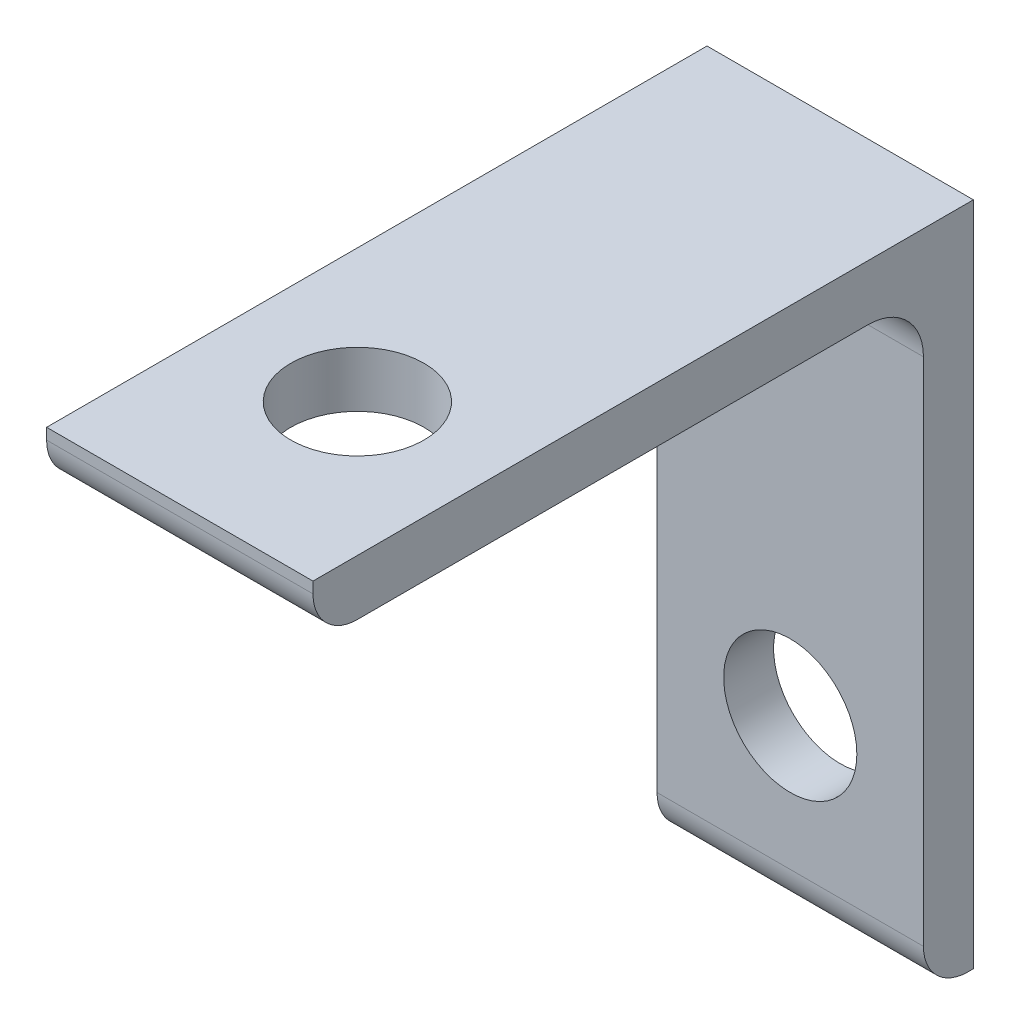
from build123d import *

# Parameters (mm, degrees)
ESBO_O1_W                = 1.2
ESBO_O1_H                = 3
RESSALTO_EXTRUS_O1_DEPTH = 0.225
ESBO_O2_W                = 2.75
ESBO_O2_H                = 0.25
RESSALTO_EXTRUS_O2_DEPTH = 1.2
RESSALTO_EXTRUS_O3_DEPTH = 1.2
CORTE_EXTRUS_O1_DEPTH    = 1.2
ESBO_O8_R                = 0.3
CORTE_EXTRUS_O2_DEPTH    = 1.2
ESBO_O9_R                = 0.3
CORTE_EXTRUS_O3_DEPTH    = 1.2


with BuildPart() as part:
    # Esboço1 → Ressalto-extrusão1 (new body)
    with BuildSketch(Plane.XY):
        with Locations((-16.903502085, -4.953296555)):
            Rectangle(ESBO_O1_W, ESBO_O1_H)
    extrude(amount=RESSALTO_EXTRUS_O1_DEPTH)

    # Esboço2 → Ressalto-extrusão2 (add)
    with BuildSketch(Plane.ZY.offset(17.503502085)):
        with Locations((1.6, -3.578296555)):
            Rectangle(ESBO_O2_W, ESBO_O2_H)
    extrude(amount=-RESSALTO_EXTRUS_O2_DEPTH)

    # Esboço6 → Ressalto-extrusão3 (add)
    with BuildSketch(Plane.ZY.offset(17.503502085)):
        with BuildLine():
            Line((0.225, -3.703296555), (0.225, -3.953296555))
            ThreePointArc((0.225, -3.953296555), (0.298223305, -3.776519859), (0.475, -3.703296555))
            Line((0.475, -3.703296555), (0.225, -3.703296555))
        make_face()
    extrude(amount=-RESSALTO_EXTRUS_O3_DEPTH)

    # Esboço7 → Corte-extrusão1 (cut)
    with BuildSketch(Plane.ZY.offset(17.503502085)):
        with BuildLine():
            Line((2.975, -3.703296555), (2.975, -3.503296555))
            ThreePointArc((2.975, -3.503296555), (2.916421356, -3.644717911), (2.775, -3.703296555))
            Line((2.775, -3.703296555), (2.975, -3.703296555))
        make_face()
        with BuildLine():
            ThreePointArc((0.225, -6.253296555), (0.166421356, -6.394717911), (0.025, -6.453296555))
            Line((0.025, -6.453296555), (0.225, -6.453296555))
            Line((0.225, -6.453296555), (0.225, -6.253296555))
        make_face()
    extrude(amount=-CORTE_EXTRUS_O1_DEPTH, mode=Mode.SUBTRACT)

    # Esboço8 → Corte-extrusão2 (cut)
    with BuildSketch(Plane.XY.offset(0.225)):
        with Locations((-16.903502085, -5.653296555)):
            Circle(ESBO_O8_R)
    extrude(amount=-CORTE_EXTRUS_O2_DEPTH, mode=Mode.SUBTRACT)

    # Esboço9 → Corte-extrusão3 (cut)
    with BuildSketch(Plane.XZ.offset(3.703296555)):
        with Locations(Location((-16.903502085, 2.175, 0), (0, 0, 270))):
            Circle(ESBO_O9_R)
    extrude(amount=-CORTE_EXTRUS_O3_DEPTH, mode=Mode.SUBTRACT)


solid = part.part
